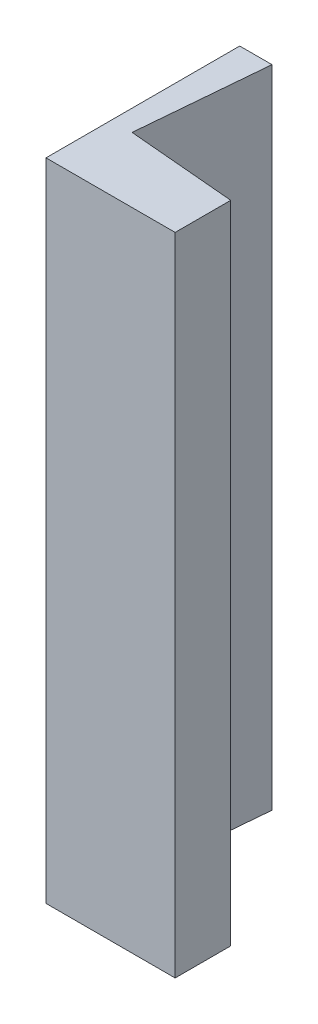
from build123d import *

# Parameters (mm, degrees)
BOSS_EXTRUDE1_DEPTH = 127


with BuildPart() as part:
    # Sketch2 → Boss-Extrude1 (new body)
    with BuildSketch(Plane(origin=(0, 0, 0), x_dir=(1, 0, 0), z_dir=(0, 1, 0))):
        Polygon((-6.35, 19.05), (-8.563755866, -6.253345332), (12.7, -8.113682914), (12.7, -19.05), (-12.7, -19.05), (-12.7, 19.05), align=None)
    extrude(amount=BOSS_EXTRUDE1_DEPTH)


solid = part.part
